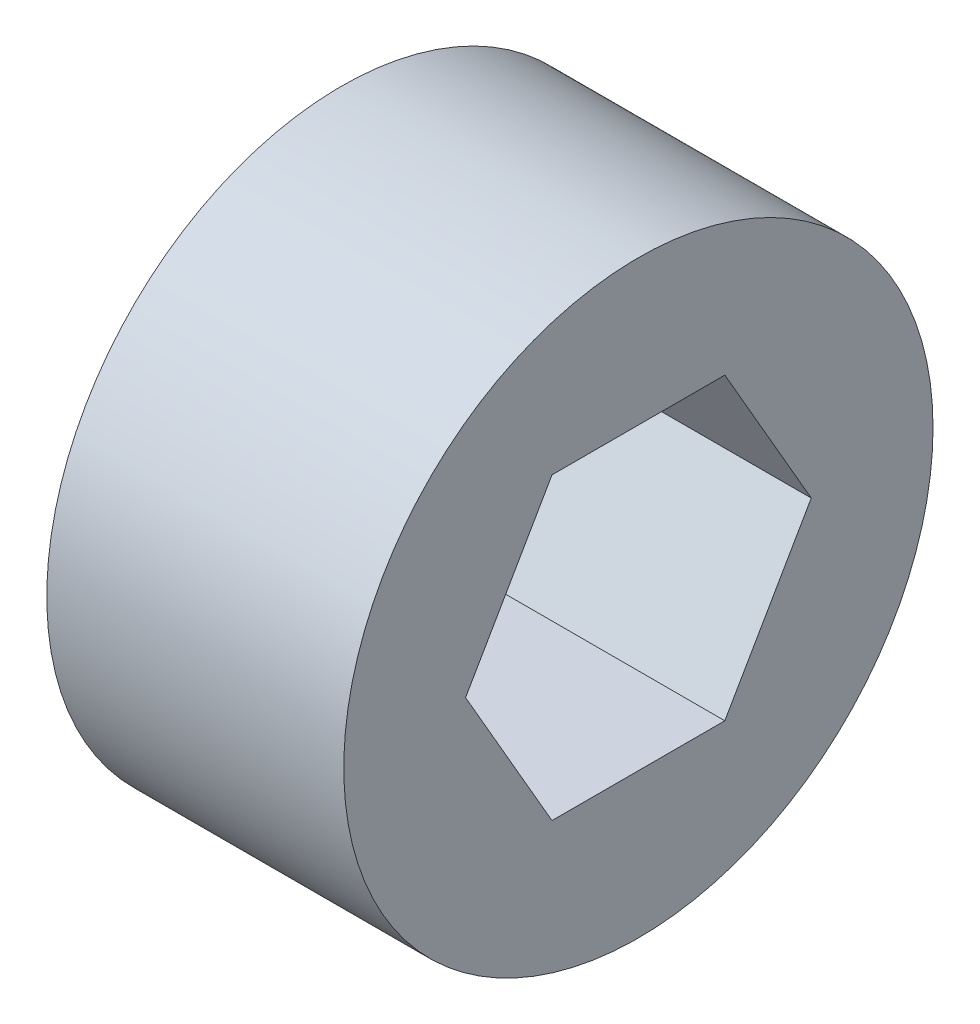
from build123d import *

# Parameters (mm, degrees)
CROQUIS1_R              = 12.5
SALIENTE_EXTRUIR1_DEPTH = 12.6


with BuildPart() as part:
    # Croquis1 → Saliente-Extruir1 (new body)
    with BuildSketch(Plane(origin=(0, 0, 0), x_dir=(0, 0, -1), z_dir=(1, 0, 0))):
        Circle(CROQUIS1_R)
        Polygon((7.332348419, 0), (3.666174209, 6.35), (-3.666174209, 6.35), (-7.332348419, 0), (-3.666174209, -6.35), (3.666174209, -6.35), align=None, mode=Mode.SUBTRACT)
    extrude(amount=SALIENTE_EXTRUIR1_DEPTH)


solid = part.part
